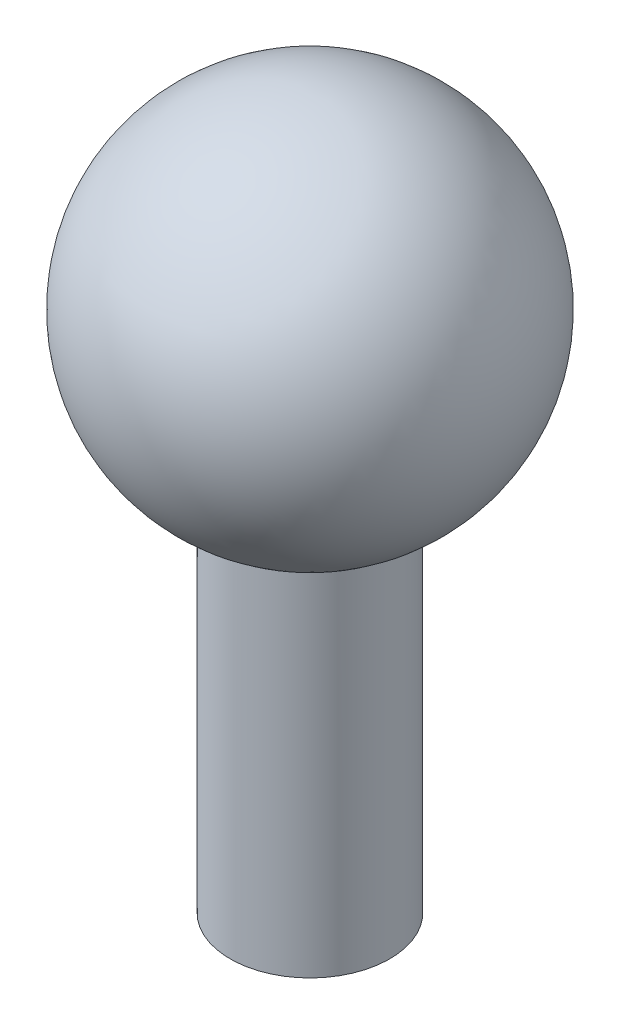
from build123d import *


with BuildPart() as part:
    # Szkic1 → Obrót1 (revolve)
    with BuildSketch(Plane.XY):
        with BuildLine():
            Line((-3, -6.32455532), (-3, -19.642320018))
            Line((-3, -19.642320018), (0, -19.642320018))
            Line((0, -19.642320018), (0, 7))
            ThreePointArc((0, 7), (-6.829051444, 1.537548822), (-3, -6.32455532))
        make_face()
    revolve(axis=Axis((0, -19.642320018, 0), (0, 1, 0)))


solid = part.part
